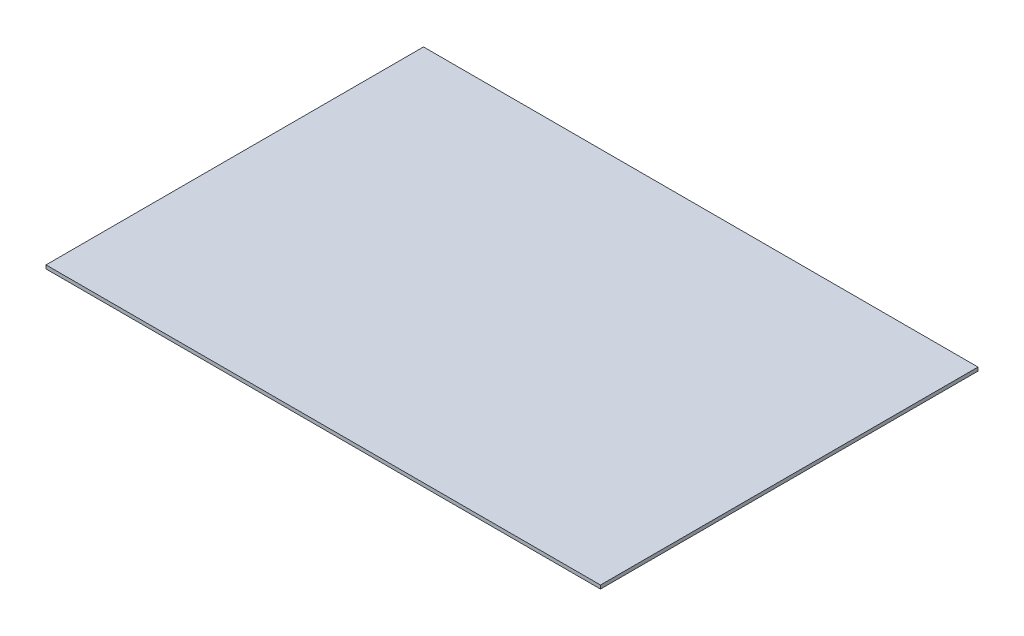
from build123d import *

# Parameters (mm, degrees)
SKETCH1_W           = 940
SKETCH1_H           = 640
BOSS_EXTRUDE1_DEPTH = 6


with BuildPart() as part:
    # Sketch1 → Boss-Extrude1 (new body)
    with BuildSketch(Plane(origin=(0, 0, 0), x_dir=(1, 0, 0), z_dir=(0, 1, 0))):
        with Locations((470, 320)):
            Rectangle(SKETCH1_W, SKETCH1_H)
    extrude(amount=BOSS_EXTRUDE1_DEPTH)


solid = part.part
